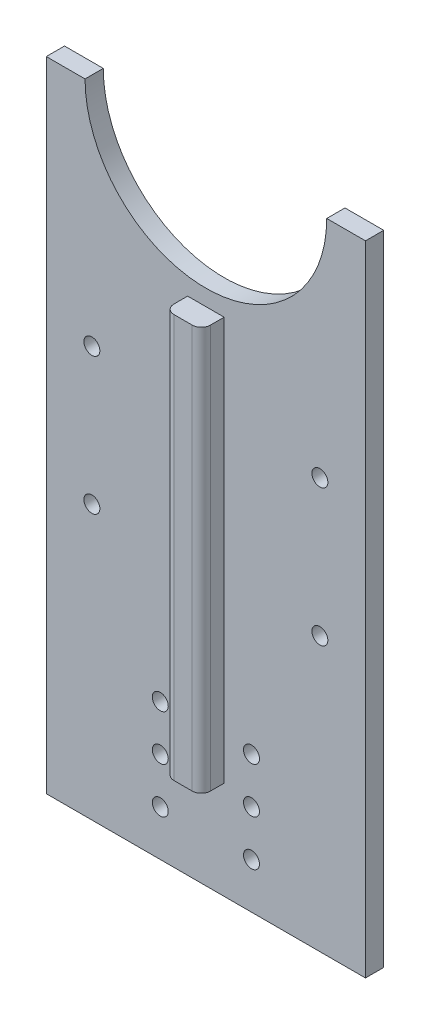
from build123d import *

# Parameters (mm, degrees)
SKETCH1_R           = 1.75
BOSS_EXTRUDE1_DEPTH = 4
SKETCH2_W           = 8
SKETCH2_H           = 88.5
BOSS_EXTRUDE2_DEPTH = 5
FILLET1_R           = 2
SKETCH3_R           = 1.75
CUT_EXTRUDE1_DEPTH  = 145.395290782


with BuildPart() as part:
    # Sketch1 → Boss-Extrude1 (new body)
    with BuildSketch(Plane.XY):
        with BuildLine():
            Line((-26.5, 140), (-35, 140))
            Line((-35, 140), (-35, 0))
            Line((-35, 0), (35, 0))
            Line((35, 0), (35, 140))
            Line((35, 140), (26.5, 140))
            ThreePointArc((26.5, 140), (0, 113.5), (-26.5, 140))
        make_face()
        with Locations((-25, 60)):
            Circle(SKETCH1_R, mode=Mode.SUBTRACT)
        with Locations((25, 60)):
            Circle(SKETCH1_R, mode=Mode.SUBTRACT)
        with Locations((-10, 10)):
            Circle(SKETCH1_R, mode=Mode.SUBTRACT)
        with Locations((10, 10)):
            Circle(SKETCH1_R, mode=Mode.SUBTRACT)
        with Locations((10, 20)):
            Circle(SKETCH1_R, mode=Mode.SUBTRACT)
        with Locations((-10, 20)):
            Circle(SKETCH1_R, mode=Mode.SUBTRACT)
        with Locations((10, 30)):
            Circle(SKETCH1_R, mode=Mode.SUBTRACT)
        with Locations((-10, 30)):
            Circle(SKETCH1_R, mode=Mode.SUBTRACT)
    extrude(amount=BOSS_EXTRUDE1_DEPTH)

    # Sketch2 → Boss-Extrude2 (add)
    with BuildSketch(Plane.XY.offset(4)):
        with Locations((0, 65.75)):
            Rectangle(SKETCH2_W, SKETCH2_H)
    extrude(amount=BOSS_EXTRUDE2_DEPTH)

    # Fillet1
    fillet1_edges = [part.edges().sort_by_distance(p)[0] for p in [
        (-4, 65.75, 9),
        (4, 65.75, 9),
    ]]
    fillet(fillet1_edges, radius=FILLET1_R)

    # Sketch3 → Cut-Extrude1 (cut, through all)
    with BuildSketch(Plane.XY.offset(4)):
        with Locations((-25, 90)):
            Circle(SKETCH3_R)
        with Locations((25, 90)):
            Circle(SKETCH3_R)
    extrude(amount=-CUT_EXTRUDE1_DEPTH, mode=Mode.SUBTRACT)


solid = part.part
